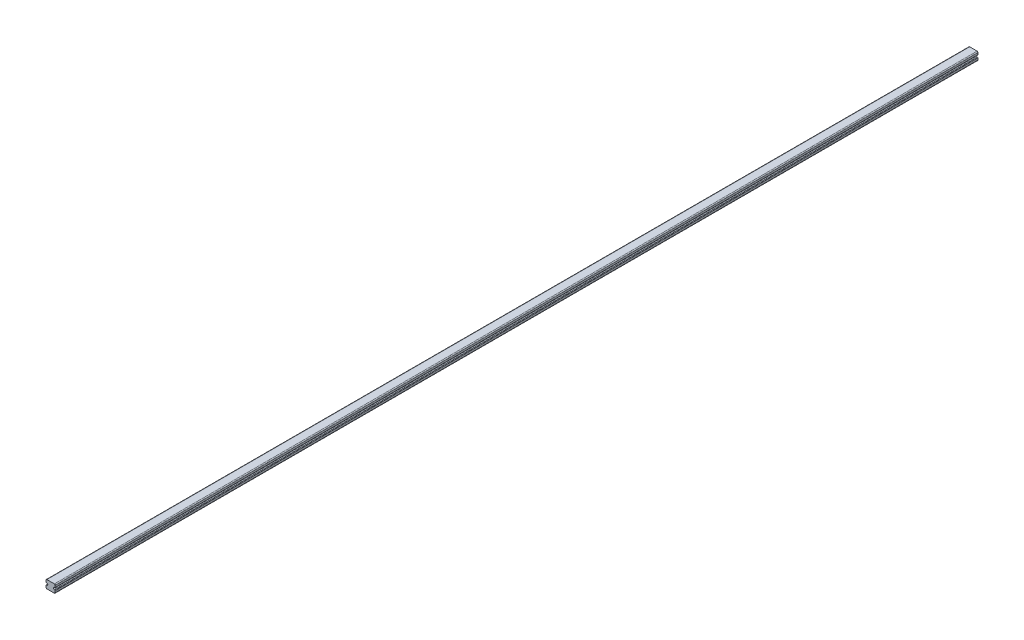
from build123d import *

# Parameters (mm, degrees)
BOSS_EXTRUDE1_DEPTH = 2000


with BuildPart() as part:
    # Sketch1 → Boss-Extrude1 (new body)
    with BuildSketch(Plane.XY):
        with BuildLine():
            Line((-8, -8.75), (8, -8.75))
            ThreePointArc((8, -8.75), (9.414213562, -8.164213562), (10, -6.75))
            Line((10, -6.75), (10, -3))
            ThreePointArc((10, -3), (9.707106781, -2.292893219), (9, -2))
            Line((9, -2), (8, -2))
            ThreePointArc((8, -2), (6, 0), (8, 2))
            Line((8, 2), (9, 2))
            ThreePointArc((9, 2), (9.707106781, 2.292893219), (10, 3))
            Line((10, 3), (10, 6.75))
            ThreePointArc((10, 6.75), (9.414213562, 8.164213562), (8, 8.75))
            Line((8, 8.75), (-8, 8.75))
            ThreePointArc((-8, 8.75), (-9.414213562, 8.164213562), (-10, 6.75))
            Line((-10, 6.75), (-10, 3))
            ThreePointArc((-10, 3), (-9.707106781, 2.292893219), (-9, 2))
            Line((-9, 2), (-8, 2))
            ThreePointArc((-8, 2), (-6, 0), (-8, -2))
            Line((-8, -2), (-9, -2))
            ThreePointArc((-9, -2), (-9.707106781, -2.292893219), (-10, -3))
            Line((-10, -3), (-10, -6.75))
            ThreePointArc((-10, -6.75), (-9.414213562, -8.164213562), (-8, -8.75))
        make_face()
    extrude(amount=BOSS_EXTRUDE1_DEPTH)


solid = part.part
